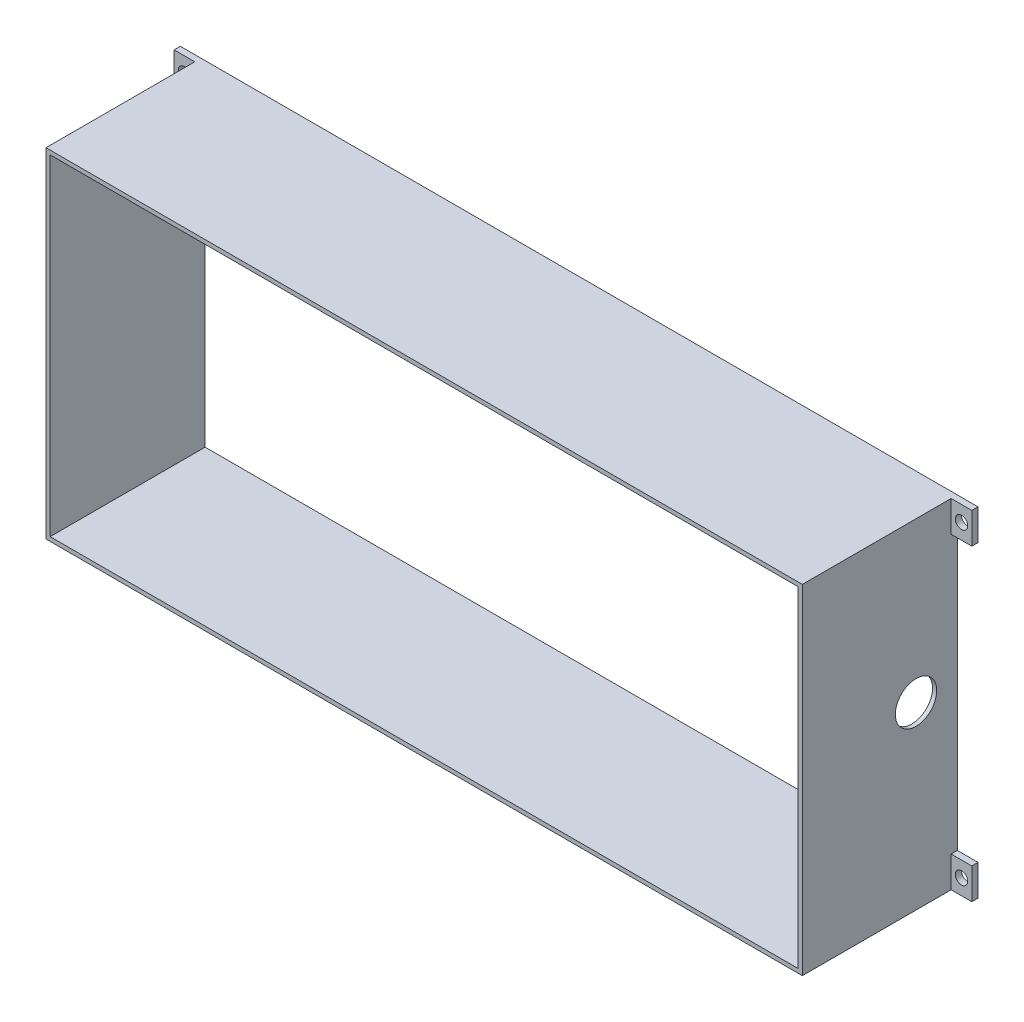
from build123d import *

# Parameters (mm, degrees)
SKETCH_1_W          = 366
SKETCH_1_H          = 164
SKETCH_1_W_2        = 362
SKETCH_1_H_2        = 160
EXTRUDE_1_DEPTH     = 75
SKETCH_2_W          = 3
SKETCH_2_H          = 15
EXTRUDE_2_DEPTH     = 10
SKETCH_3_R          = 3
CUT_EXTRUDE_1_DEPTH = 10
SKETCH_4_R          = 10
CUT_EXTRUDE_2_DEPTH = 10


with BuildPart() as part:
    # 草圖1 → 填料-伸長1 (new body)
    with BuildSketch(Plane.XY):
        Rectangle(SKETCH_1_W, SKETCH_1_H)
        Rectangle(SKETCH_1_W_2, SKETCH_1_H_2, mode=Mode.SUBTRACT)
    extrude(amount=EXTRUDE_1_DEPTH)

    # 草圖2 → 填料-伸長2 (add)
    with BuildSketch(Plane(origin=(183, 0, 0), x_dir=(0, 0, -1), z_dir=(1, 0, 0))):
        with Locations((-1.5, 74.5)):
            Rectangle(SKETCH_2_W, SKETCH_2_H)
        with Locations((-1.5, -74.5)):
            Rectangle(SKETCH_2_W, SKETCH_2_H)
    extrude_2 = extrude(amount=EXTRUDE_2_DEPTH)

    # 鏡射1: 填料-伸長2 across plane
    add(extrude_2.mirror(Plane(origin=(0, 0, 0), x_dir=(0, 0, 1), z_dir=(1, 0, 0))))

    # 草圖3 → 除料-伸長1 (cut)
    with BuildSketch(Plane.XY.offset(3)):
        with Locations((188, 74.5)):
            Circle(SKETCH_3_R)
        with Locations((188, -74.5)):
            Circle(SKETCH_3_R)
    cut_extrude_1 = extrude(amount=-CUT_EXTRUDE_1_DEPTH, mode=Mode.SUBTRACT)

    # 鏡射3: 除料-伸長1 across plane
    add(cut_extrude_1.mirror(Plane(origin=(0, 0, 0), x_dir=(0, 0, 1), z_dir=(1, 0, 0))), mode=Mode.SUBTRACT)

    # 草圖4 → 除料-伸長2 (cut)
    with BuildSketch(Plane(origin=(183, 0, 0), x_dir=(0, 0, -1), z_dir=(1, 0, 0))):
        with Locations(Location((-20, 5, 0), (0, 0, 90))):
            Circle(SKETCH_4_R)
    extrude(amount=-CUT_EXTRUDE_2_DEPTH, mode=Mode.SUBTRACT)


solid = part.part
